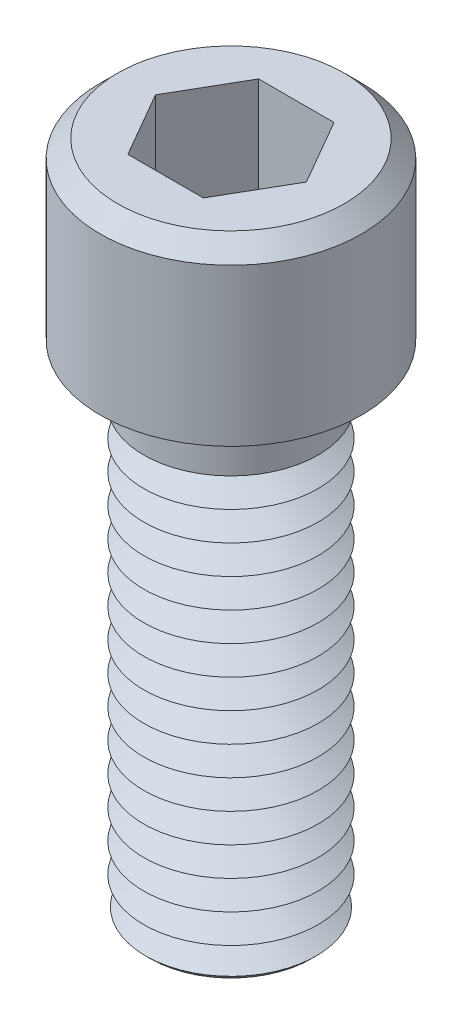
from build123d import *

# Parameters (mm, degrees)
HEX_CUT_DRIVEN_DEPTH = 1.52908


with BuildPart() as part:
    # Sketch3 → Shank Revolve ( driven ) (revolve)
    with BuildSketch(Plane.XY, mode=Mode.PRIVATE) as shank_revolve_driven_sk:
        Polygon((0, 0.65532), (0, -6.35), (0.87376, -6.35), (1.0922, -6.13156), (1.0922, 0.65532), align=None)
    revolve(shank_revolve_driven_sk.sketch.rotate(Axis((0, -50, 0), (0, 1, 0)), 90), axis=Axis((0, -50, 0), (0, 1, 0)))

    # Sketch4 → Thread Revolve Cut ( driven ) (revolve, cut)
    with BuildSketch(Plane.XY, mode=Mode.PRIVATE) as thread_revolve_cut_driven_sk:
        Polygon((0.776909018, -0.889), (1.0922, -0.706966667), (1.633740037, -0.706966667), (1.633740037, -7.260166667), (1.0922, -7.260166667), (0.776909018, -7.078133333), (1.0922, -6.8961), (0.776909018, -6.714066667), (1.0922, -6.532033333), (0.776909018, -6.35), (1.0922, -6.167966667), (0.776909018, -5.985933333), (1.0922, -5.8039), (0.776909018, -5.621866667), (1.0922, -5.439833333), (0.776909018, -5.2578), (1.0922, -5.075766667), (0.776909018, -4.893733333), (1.0922, -4.7117), (0.776909018, -4.529666667), (1.0922, -4.347633333), (0.776909018, -4.1656), (1.0922, -3.983566667), (0.776909018, -3.801533333), (1.0922, -3.6195), (0.776909018, -3.437466667), (1.0922, -3.255433333), (0.776909018, -3.0734), (1.0922, -2.891366667), (0.776909018, -2.709333333), (1.0922, -2.5273), (0.776909018, -2.345266667), (1.0922, -2.163233333), (0.776909018, -1.9812), (1.0922, -1.799166667), (0.776909018, -1.617133333), (1.0922, -1.4351), (0.776909018, -1.253066667), (1.0922, -1.071033333), align=None)
    revolve(thread_revolve_cut_driven_sk.sketch.rotate(Axis((0, -50, 0), (0, 1, 0)), 90), axis=Axis((0, -50, 0), (0, 1, 0)), mode=Mode.SUBTRACT)

    # Sketch5 → Head Revolve ( driven ) (revolve)
    with BuildSketch(Plane.XY, mode=Mode.PRIVATE) as head_revolve_driven_sk:
        Polygon((0, 2.1844), (0, 0), (1.6383, 0), (1.6383, 1.96596), (1.41986, 2.1844), align=None)
    revolve(head_revolve_driven_sk.sketch.rotate(Axis((0, -50, 0), (0, 1, 0)), 90), axis=Axis((0, -50, 0), (0, 1, 0)))

    # Sketch2 → Hex Cut ( driven ) (cut)
    with BuildSketch(Plane(origin=(0, 2.1844, 0), x_dir=(-1, 0, 0), z_dir=(0, 1, 0))):
        Polygon((-0.945872946, 0), (-0.472936473, -0.81915), (0.472936473, -0.81915), (0.945872946, 0), (0.472936473, 0.81915), (-0.472936473, 0.81915), align=None)
    extrude(amount=-HEX_CUT_DRIVEN_DEPTH, mode=Mode.SUBTRACT)


solid = part.part
